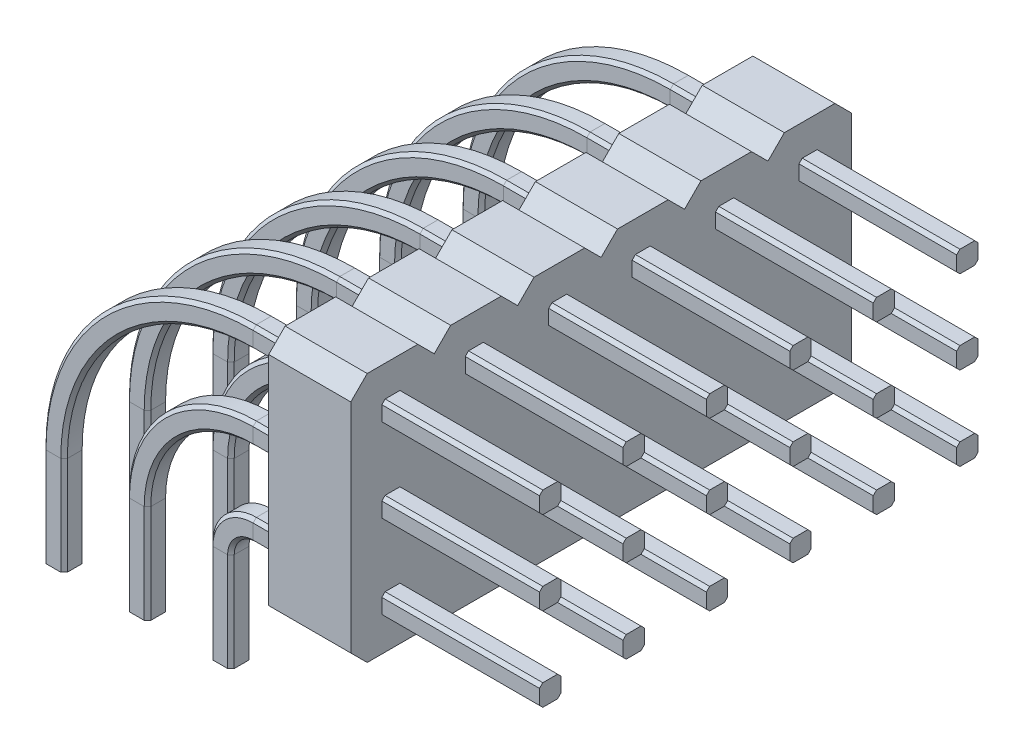
from build123d import *

# Parameters (mm, degrees)
BOSS_EXTRUDE1_DEPTH = 2.5
LPATTERN1_COUNT     = 6
LPATTERN1_PITCH     = 2.54


with BuildPart() as part:
    # Sweep2: sweep along a path in Sketch2
    with BuildLine(Plane.XY) as sweep2_path:
        Line((5.08, 0), (5.08, 3))
        ThreePointArc((5.08, 3), (5.372893219, 3.707106781), (6.08, 4))
        Line((6.08, 4), (14.8, 4))
    # Sketch1 → Sweep2 (sweep)
    with BuildSketch(Plane(origin=(0, 0, 0), x_dir=(1, 0, 0), z_dir=(0, 1, 0))):
        Polygon((-0.325, 0.225), (-0.225, 0.325), (0.225, 0.325), (0.325, 0.225), (0.325, -0.225), (0.225, -0.325), (-0.225, -0.325), (-0.325, -0.225), align=None)
        Polygon((2.215, 0.225), (2.315, 0.325), (2.765, 0.325), (2.865, 0.225), (2.865, -0.225), (2.765, -0.325), (2.315, -0.325), (2.215, -0.225), align=None)
        Polygon((4.755, 0.225), (4.855, 0.325), (5.305, 0.325), (5.405, 0.225), (5.405, -0.225), (5.305, -0.325), (4.855, -0.325), (4.755, -0.225), align=None)
    sweep(path=sweep2_path.line)

    # Sketch4 → Boss-Extrude1 (add)
    with BuildSketch(Plane(origin=(7.5, 0, 0), x_dir=(0, 0, -1), z_dir=(1, 0, 0))):
        Polygon((-0.77, 10.35), (0.77, 10.35), (1.27, 9.85), (1.27, 3.23), (0.77, 2.73), (-0.77, 2.73), (-1.27, 3.23), (-1.27, 9.85), align=None)
    extrude(amount=BOSS_EXTRUDE1_DEPTH)


with BuildPart() as lpattern1_1:
    # LPattern1: pattern copy
    add(part.part.moved(Location(Vector(0, 0, 1) * (1 * LPATTERN1_PITCH))))


with BuildPart() as lpattern1_2:
    # LPattern1: pattern copy
    add(part.part.moved(Location(Vector(0, 0, 1) * (2 * LPATTERN1_PITCH))))


with BuildPart() as lpattern1_3:
    # LPattern1: pattern copy
    add(part.part.moved(Location(Vector(0, 0, 1) * (3 * LPATTERN1_PITCH))))


with BuildPart() as lpattern1_4:
    # LPattern1: pattern copy
    add(part.part.moved(Location(Vector(0, 0, 1) * (4 * LPATTERN1_PITCH))))


with BuildPart() as lpattern1_5:
    # LPattern1: pattern copy
    add(part.part.moved(Location(Vector(0, 0, 1) * (5 * LPATTERN1_PITCH))))


with BuildPart() as lpattern1_2_1:
    add(lpattern1_2.part)

    # Combine1: union LPattern1_5, LPattern1_3, LPattern1_1, LPattern1_4, part
    add(lpattern1_5.part)
    add(lpattern1_3.part)
    add(lpattern1_1.part)
    add(lpattern1_4.part)
    add(part.part)


solid = lpattern1_2_1.part
